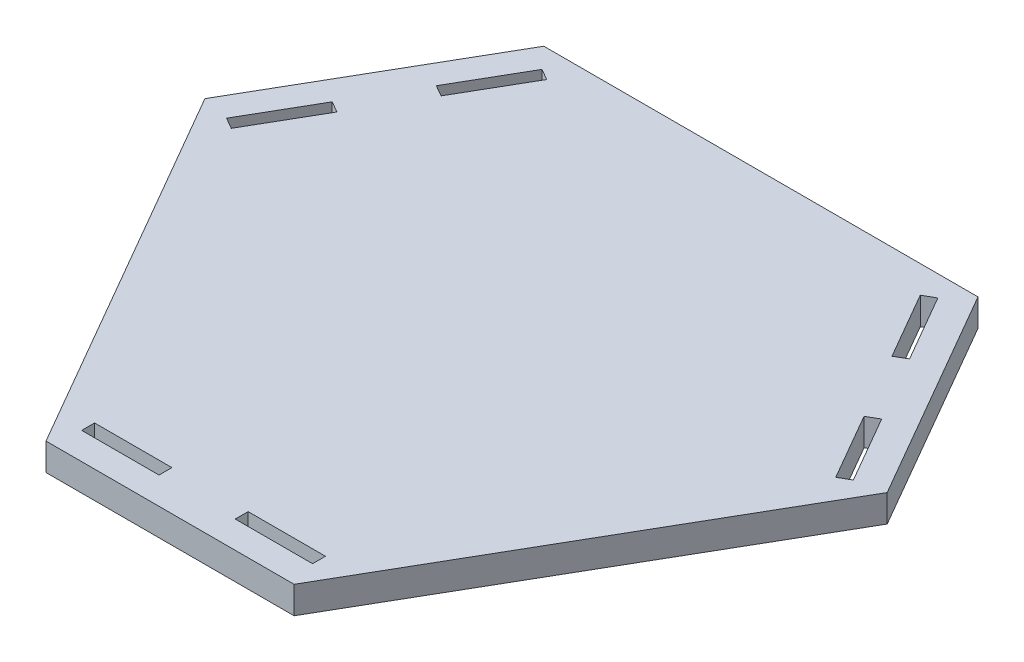
from build123d import *

# Parameters (mm, degrees)
BOSS_EXTRUDE1_DEPTH = 6.35
SKETCH2_W           = 18
SKETCH2_H           = 3
CUT_EXTRUDE1_DEPTH  = 110.395639005


with BuildPart() as part:
    # Sketch1 → Boss-Extrude1 (new body)
    with BuildSketch(Plane(origin=(0, 0, 0), x_dir=(1, 0, 0), z_dir=(0, 1, 0))):
        Polygon((50.518148554, 62.5), (-50.518148554, 62.5), (-79.385662014, 12.5), (-28.867513459, -75), (28.867513459, -75), (79.385662014, 12.5), align=None)
    extrude(amount=BOSS_EXTRUDE1_DEPTH)

    # Sketch2 → Cut-Extrude1 (cut, through all)
    with BuildSketch(Plane(origin=(0, 6.35, 0), x_dir=(1, 0, 0), z_dir=(0, 1, 0))):
        with Locations((-17.867513459, -67.2)):
            Rectangle(SKETCH2_W, SKETCH2_H)
        with Locations((17.867513459, -67.2)):
            Rectangle(SKETCH2_W, SKETCH2_H)
        Polygon((-46.06218851, 57.617949192), (-43.464112299, 56.117949192), (-52.464112299, 40.529491924), (-55.06218851, 42.029491924), align=None)
        Polygon((-70.331625758, 9.582050808), (-61.331625758, 25.170508076), (-63.92970197, 26.670508076), (-72.92970197, 11.082050808), align=None)
        Polygon((72.92970197, 11.082050808), (63.92970197, 26.670508076), (61.331625758, 25.170508076), (70.331625758, 9.582050808), align=None)
        Polygon((43.464112299, 56.117949192), (46.06218851, 57.617949192), (55.06218851, 42.029491924), (52.464112299, 40.529491924), align=None)
    extrude(amount=-CUT_EXTRUDE1_DEPTH, mode=Mode.SUBTRACT)


solid = part.part
